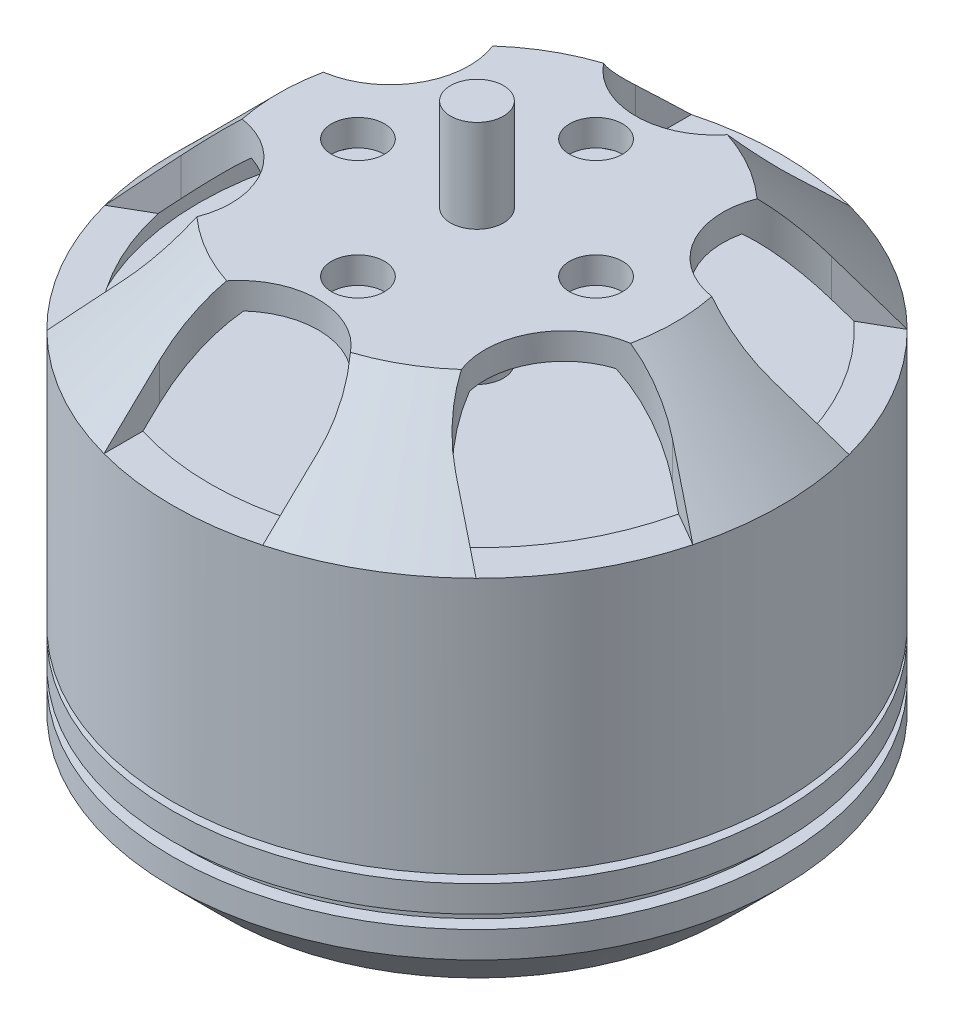
from build123d import *

# Parameters (mm, degrees)
SKETCH2_R          = 1
CUT_EXTRUDE1_DEPTH = 4
SKETCH4_R          = 1
CUT_EXTRUDE3_DEPTH = 3


with BuildPart() as part:
    # Sketch1 → Revolve1 (revolve)
    with BuildSketch(Plane.XY, mode=Mode.PRIVATE) as revolve1_sk:
        Polygon((0, 22), (0, -1.8), (1, -1.8), (1, 0), (9.5, 0), (11.5, 2), (11.5, 3), (11, 3), (11, 3.5), (11.5, 3.5), (11.5, 4.5), (9.5, 4.5), (9.5, 4.8), (11.5, 4.8), (11.5, 14.5), (7.5, 18.5), (1, 18.5), (1, 22), align=None)
        Polygon((1, 16.5), (1, 13.419161277), (10.5, 13.419161277), (10.5, 14.085786438), (7.085786438, 17.5), (2, 17.5), (2, 16.5), align=None, mode=Mode.SUBTRACT)
    revolve(revolve1_sk.sketch.rotate(Axis((0, 22, 0), (0, -1, 0)), 180), axis=Axis((0, 22, 0), (0, -1, 0)))

    # Sketch2 → Cut-Extrude1 (cut)
    with BuildSketch(Plane(origin=(0, 18.5, 0), x_dir=(1, 0, 0), z_dir=(0, 1, 0))):
        with Locations(Location((0, 4.5, 0), (0, 0, 180))):
            Circle(SKETCH2_R)
        with Locations(Location((4.5, 0, 0), (0, 0, 180))):
            Circle(SKETCH2_R)
        with Locations(Location((0, -4.5, 0), (0, 0, 180))):
            Circle(SKETCH2_R)
        with Locations(Location((-4.5, 0, 0), (0, 0, 180))):
            Circle(SKETCH2_R)
        with BuildLine():
            Line((-3, 9), (-3, 13.152327235))
            Line((-3, 13.152327235), (3, 13.152327235))
            Line((3, 13.152327235), (3, 9))
            ThreePointArc((3, 9), (0, 6), (-3, 9))
        make_face()
        with BuildLine():
            Line((12.890249504, 3.978087406), (9.294228634, 1.901923789))
            ThreePointArc((9.294228634, 1.901923789), (5.196152423, 3), (6.294228634, 7.098076211))
            Line((6.294228634, 7.098076211), (9.890249504, 9.174239829))
            Line((9.890249504, 9.174239829), (12.890249504, 3.978087406))
        make_face()
        with BuildLine():
            Line((9.890249504, -9.174239829), (6.294228634, -7.098076211))
            ThreePointArc((6.294228634, -7.098076211), (5.196152423, -3), (9.294228634, -1.901923789))
            Line((9.294228634, -1.901923789), (12.890249504, -3.978087406))
            Line((12.890249504, -3.978087406), (9.890249504, -9.174239829))
        make_face()
        with BuildLine():
            Line((-3, -13.152327235), (-3, -9))
            ThreePointArc((-3, -9), (0, -6), (3, -9))
            Line((3, -9), (3, -13.152327235))
            Line((3, -13.152327235), (-3, -13.152327235))
        make_face()
        with BuildLine():
            Line((-12.890249504, -3.978087406), (-9.294228634, -1.901923789))
            ThreePointArc((-9.294228634, -1.901923789), (-5.196152423, -3), (-6.294228634, -7.098076211))
            Line((-6.294228634, -7.098076211), (-9.890249504, -9.174239829))
            Line((-9.890249504, -9.174239829), (-12.890249504, -3.978087406))
        make_face()
        with BuildLine():
            Line((-9.890249504, 9.174239829), (-6.294228634, 7.098076211))
            ThreePointArc((-6.294228634, 7.098076211), (-5.196152423, 3), (-9.294228634, 1.901923789))
            Line((-9.294228634, 1.901923789), (-12.890249504, 3.978087406))
            Line((-12.890249504, 3.978087406), (-9.890249504, 9.174239829))
        make_face()
    extrude(amount=-CUT_EXTRUDE1_DEPTH, mode=Mode.SUBTRACT)

    # Sketch4 → Cut-Extrude3 (cut)
    with BuildSketch(Plane.XZ):
        with Locations((0, 6)):
            Circle(SKETCH4_R)
        with Locations((0, -6)):
            Circle(SKETCH4_R)
        with Locations((6, 0)):
            Circle(SKETCH4_R)
        with Locations((-8, 0)):
            Circle(SKETCH4_R)
    extrude(amount=-CUT_EXTRUDE3_DEPTH, mode=Mode.SUBTRACT)


solid = part.part
